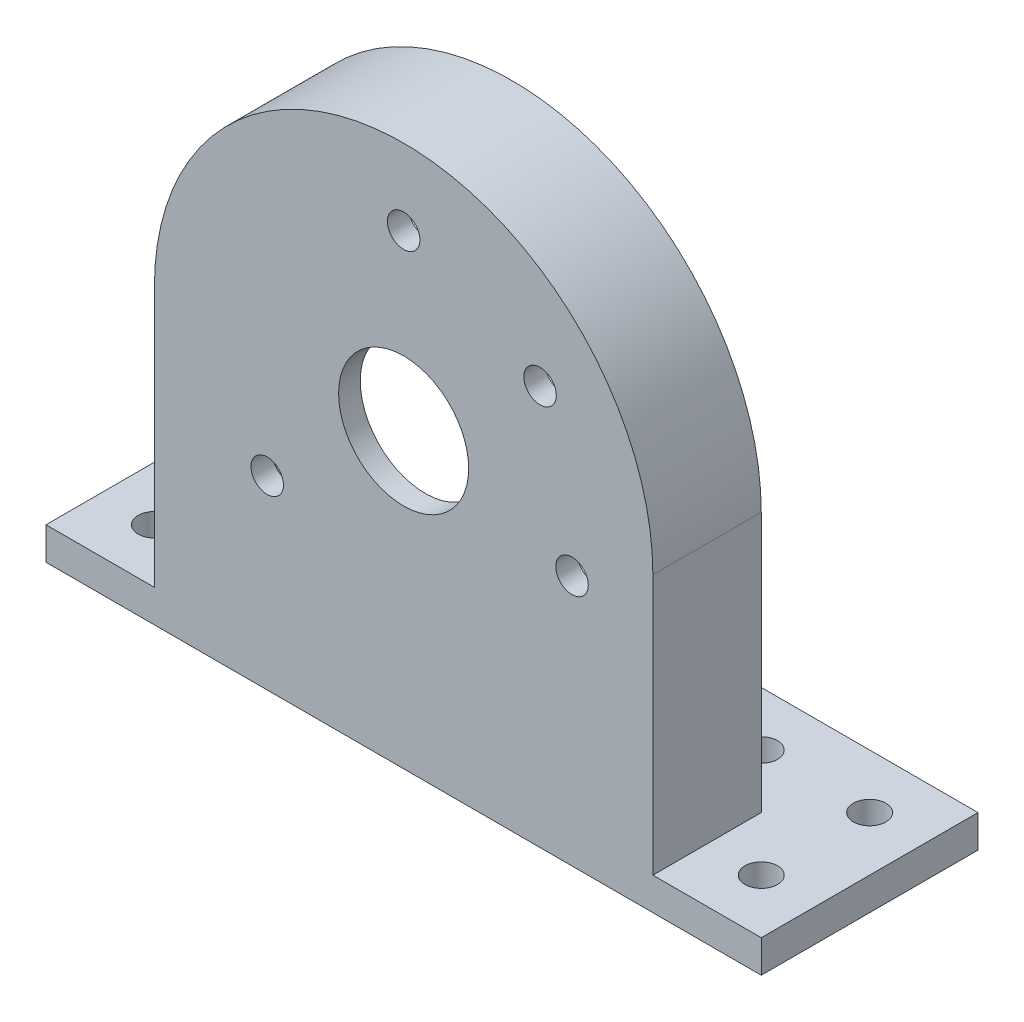
from build123d import *

# Parameters (mm, degrees)
EXTRUDE_1_DEPTH     = 20
CUT_EXTRUDE_1_DEPTH = 10
SKETCH_3_R          = 21
CUT_EXTRUDE_2_DEPTH = 8
SKETCH_6_R          = 1.5
CUT_EXTRUDE_3_DEPTH = 5
SKETCH_7_R          = 1.5
CUT_EXTRUDE_6_DEPTH = 3
SKETCH_8_R          = 6
CUT_EXTRUDE_7_DEPTH = 3
SKETCH_9_W          = 10
SKETCH_9_H          = 20
SKETCH_9_R          = 1.5
EXTRUDE_2_DEPTH     = 3


with BuildPart() as part:
    # 草图1 → 凸台-拉伸1 (new body)
    with BuildSketch(Plane.XY):
        with BuildLine():
            Line((-23, 0), (-23, -27))
            Line((-23, -27), (23, -27))
            Line((23, -27), (23, 0))
            ThreePointArc((23, 0), (0, 23), (-23, 0))
        make_face()
    extrude(amount=EXTRUDE_1_DEPTH)

    # 草图2 → 切除-拉伸1 (cut)
    with BuildSketch(Plane(origin=(0, 0, 0), x_dir=(-1, 0, 0), z_dir=(0, 0, -1))):
        with BuildLine():
            Line((-23, -24), (23, -24))
            Line((23, -24), (23, 0))
            ThreePointArc((23, 0), (0, 23), (-23, 0))
            Line((-23, 0), (-23, -24))
        make_face()
    extrude(amount=-CUT_EXTRUDE_1_DEPTH, mode=Mode.SUBTRACT)

    # 草图3 → 切除-拉伸2 (cut)
    with BuildSketch(Plane(origin=(0, 0, 10), x_dir=(-1, 0, 0), z_dir=(0, 0, -1))):
        Circle(SKETCH_3_R)
    extrude(amount=-CUT_EXTRUDE_2_DEPTH, mode=Mode.SUBTRACT)

    # 草图6 → 切除-拉伸3 (cut)
    with BuildSketch(Plane.XZ.offset(27)):
        with Locations(Location((-18, 15, 0), (0, 0, 270))):
            Circle(SKETCH_6_R)
        with Locations(Location((18, 15, 0), (0, 0, 90))):
            Circle(SKETCH_6_R)
        with Locations(Location((18, 5, 0), (0, 0, 270))):
            Circle(SKETCH_6_R)
        with Locations(Location((-18, 5, 0), (0, 0, 270))):
            Circle(SKETCH_6_R)
    extrude(amount=-CUT_EXTRUDE_3_DEPTH, mode=Mode.SUBTRACT)

    # 草图7 → 切除-拉伸6 (cut)
    with BuildSketch(Plane.XY.offset(20)):
        with Locations((0, 16)):
            Circle(SKETCH_7_R)
        with Locations((12.589057749, 9.875)):
            Circle(SKETCH_7_R)
        with Locations((-12.589057749, -9.875)):
            Circle(SKETCH_7_R)
        with Locations((15.539618159, -3.810546875)):
            Circle(SKETCH_7_R)
    extrude(amount=-CUT_EXTRUDE_6_DEPTH, mode=Mode.SUBTRACT)

    # 草图8 → 切除-拉伸7 (cut)
    with BuildSketch(Plane(origin=(0, 0, 18), x_dir=(-1, 0, 0), z_dir=(0, 0, -1))):
        Circle(SKETCH_8_R)
    extrude(amount=-CUT_EXTRUDE_7_DEPTH, mode=Mode.SUBTRACT)

    # 草图9 → 凸台-拉伸2 (add)
    # profile 1 of 2: a face of its own
    with BuildSketch(Plane.XZ.offset(27)):
        with Locations((28, 10)):
            Rectangle(SKETCH_9_W, SKETCH_9_H)
        with Locations(Location((28, 15, 0), (0, 0, 270))):
            Circle(SKETCH_9_R, mode=Mode.SUBTRACT)
        with Locations(Location((28, 5, 0), (0, 0, 270))):
            Circle(SKETCH_9_R, mode=Mode.SUBTRACT)
    # profile 2 of 2: a face of its own
    with BuildSketch(Plane.XZ.offset(27)):
        with Locations((-28, 10)):
            Rectangle(SKETCH_9_W, SKETCH_9_H)
        with Locations(Location((-28, 15, 0), (0, 0, 90))):
            Circle(SKETCH_9_R, mode=Mode.SUBTRACT)
        with Locations(Location((-28, 5, 0), (0, 0, 90))):
            Circle(SKETCH_9_R, mode=Mode.SUBTRACT)
    extrude(amount=-EXTRUDE_2_DEPTH)


solid = part.part
